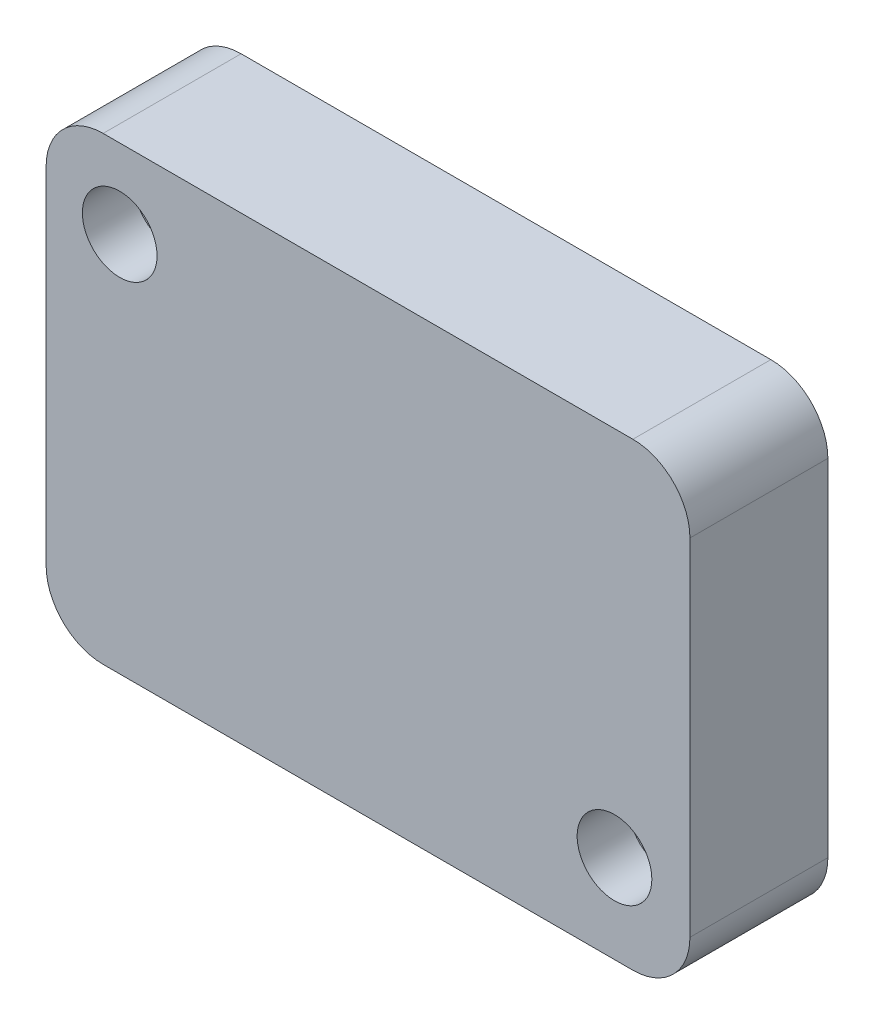
from build123d import *

# Parameters (mm, degrees)
DIE_DEPTH                                      = 19.05
DRILL_CBORE_FOR_1_4_SHCS_SHALLOW_1_D           = 7.1374
DRILL_CBORE_FOR_1_4_SHCS_SHALLOW_1_CBORE_D     = 10.3124
DRILL_CBORE_FOR_1_4_SHCS_SHALLOW_1_CBORE_DEPTH = 7.112


with BuildPart() as part:
    # Sketch1 → Die (new body)
    with BuildSketch(Plane.XY):
        with BuildLine():
            Line((-81.026, 63.5), (-7.874, 63.5))
            ThreePointArc((-7.874, 63.5), (-2.306241205, 61.193758795), (0, 55.626))
            Line((0, 55.626), (0, 7.874))
            ThreePointArc((0, 7.874), (-2.306241205, 2.306241205), (-7.874, 0))
            Line((-7.874, 0), (-81.026, 0))
            ThreePointArc((-81.026, 0), (-86.593758795, 2.306241205), (-88.9, 7.874))
            Line((-88.9, 7.874), (-88.9, 55.626))
            ThreePointArc((-88.9, 55.626), (-86.593758795, 61.193758795), (-81.026, 63.5))
        make_face()
    extrude(amount=DIE_DEPTH)

    # Drill&CBore For 1/4 SHCS (Shallow)1 (through all)
    with Locations(Plane.XY.offset(19.05)):
        with Locations((-10.414, 12.192), (-78.74, 52.578)):
            CounterBoreHole(DRILL_CBORE_FOR_1_4_SHCS_SHALLOW_1_D / 2, DRILL_CBORE_FOR_1_4_SHCS_SHALLOW_1_CBORE_D / 2, DRILL_CBORE_FOR_1_4_SHCS_SHALLOW_1_CBORE_DEPTH)


solid = part.part
